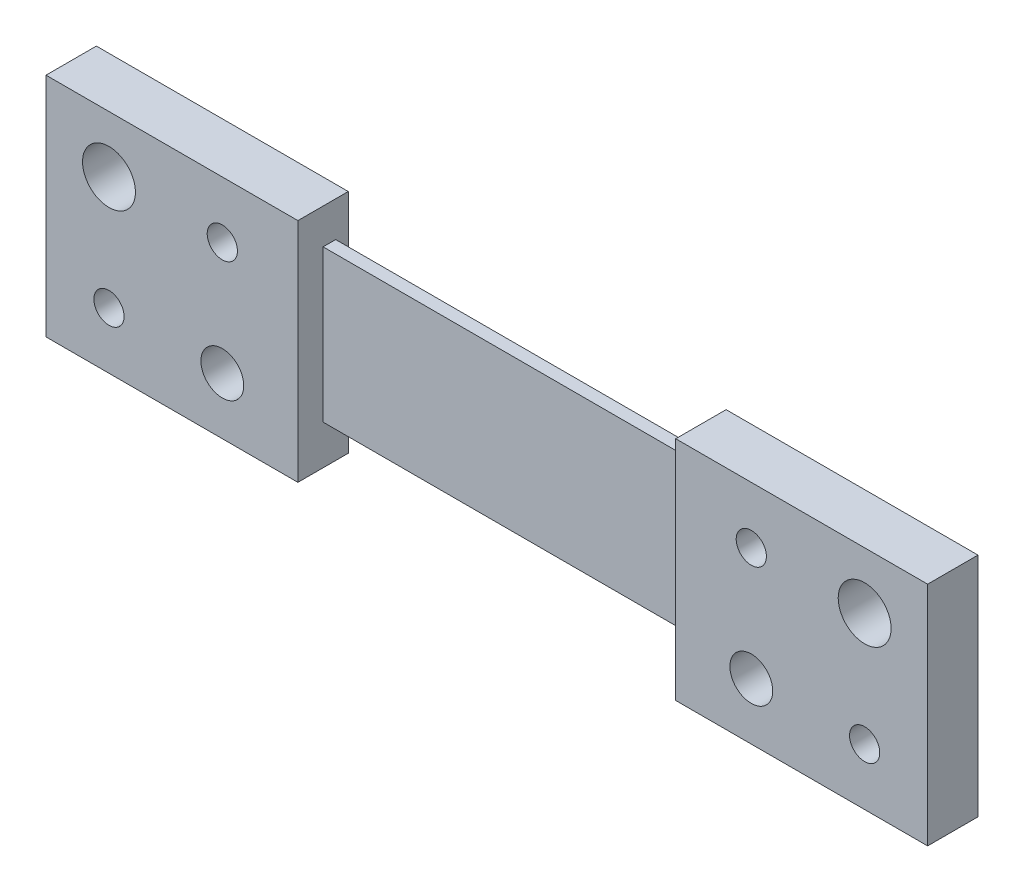
from build123d import *

# Parameters (mm, degrees)
SKETCH_1_W        = 20
SKETCH_1_H        = 18
SKETCH_1_R        = 1.2
SKETCH_1_R_2      = 1.7
SKETCH_1_R_3      = 2.1
EXTRUDE_1_DEPTH   = 4
EXTRUDE_1_2_DEPTH = 4
SKETCH_2_W        = 33.123219373
SKETCH_2_H        = 12.052469136
EXTRUDE_2_DEPTH   = 1


with BuildPart() as part:
    # Эскиз1 → Вытянуть1 (new body)
    with BuildSketch(Plane.XY):
        with Locations((25, 0)):
            Rectangle(SKETCH_1_W, SKETCH_1_H)
        with Locations(Location((30, -4.5, 0), (0, 0, 180))):
            Circle(SKETCH_1_R, mode=Mode.SUBTRACT)
        with Locations(Location((21, -4.5, 0), (0, 0, 180))):
            Circle(SKETCH_1_R_2, mode=Mode.SUBTRACT)
        with Locations(Location((21, 4.5, 0), (0, 0, 180))):
            Circle(SKETCH_1_R, mode=Mode.SUBTRACT)
        with Locations(Location((30, 4.5, 0), (0, 0, 180))):
            Circle(SKETCH_1_R_3, mode=Mode.SUBTRACT)
    extrude(amount=EXTRUDE_1_DEPTH)



with BuildPart() as body_2:
    # Эскиз1 → Extrude 1 2 (new body)
    with BuildSketch(Plane.XY):
        with Locations((-25, 0)):
            Rectangle(SKETCH_1_W, SKETCH_1_H)
        with Locations((-30, 4.5)):
            Circle(SKETCH_1_R_3, mode=Mode.SUBTRACT)
        with Locations((-21, 4.5)):
            Circle(SKETCH_1_R, mode=Mode.SUBTRACT)
        with Locations((-21, -4.5)):
            Circle(SKETCH_1_R_2, mode=Mode.SUBTRACT)
        with Locations((-30, -4.5)):
            Circle(SKETCH_1_R, mode=Mode.SUBTRACT)
    extrude(amount=EXTRUDE_1_2_DEPTH)


with BuildPart() as part_1:
    add(part.part)

    add(body_2.part)  # Вытянуть2 merges body 2
    # Эскиз2 → Вытянуть2 (add)
    with BuildSketch(Plane(origin=(0, 0, 2), x_dir=(-1, 0, 0), z_dir=(0, 0, -1))):
        with Locations((0.036443495, 0.168566002)):
            Rectangle(SKETCH_2_W, SKETCH_2_H)
    extrude(amount=EXTRUDE_2_DEPTH)


solid = part_1.part
